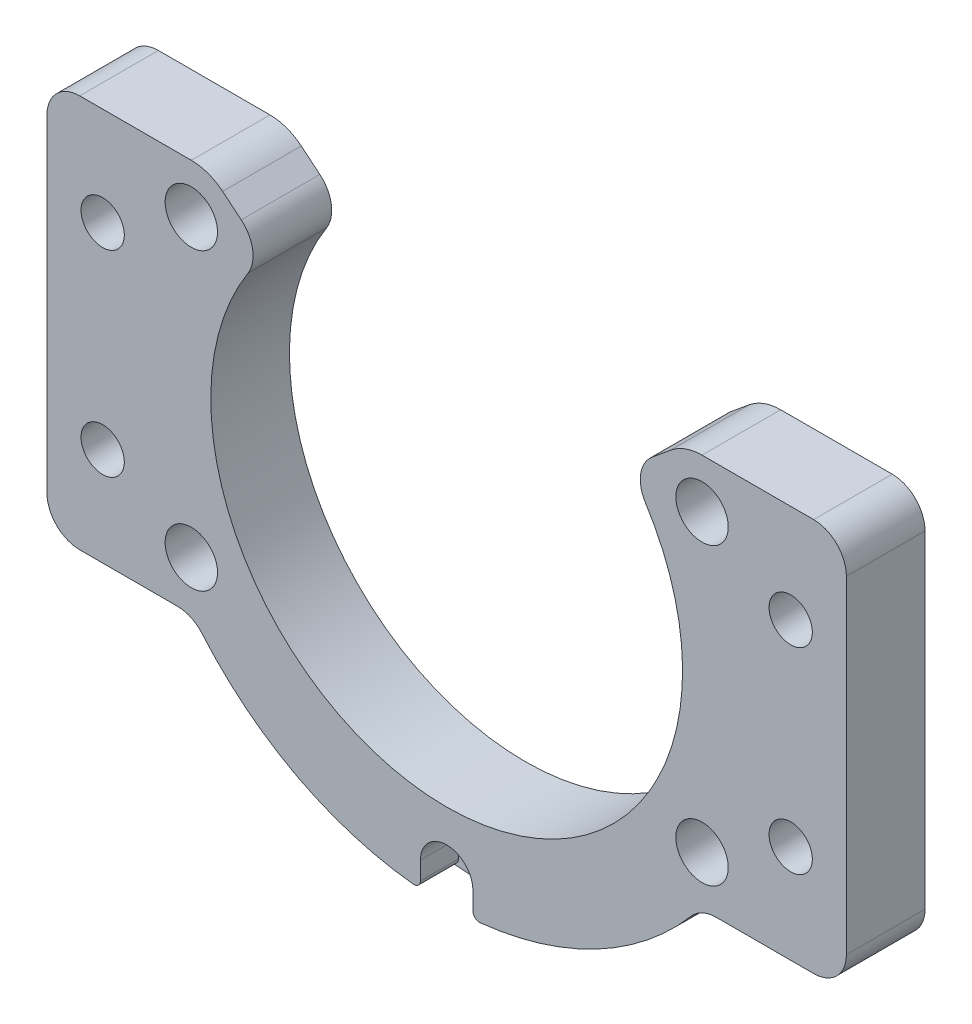
from build123d import *

# Parameters (mm, degrees)
EXTRUDE_1_DEPTH              = 12
CUT_EXTRUDE_1_DEPTH          = 80.158069709
CUT_EXTRUDE_START            = -5.8
CUT_EXTRUDE_2_DEPTH          = 5.8
HOLE_WIZARD_4_5_4_5_1_D      = 4.5
HOLE_WIZARD_M64_1_D          = 72
HOLE_WIZARD_M6_1_D           = 6.6
HOLE_WIZARD_M6_1_CBORE_D     = 11
HOLE_WIZARD_M6_1_CBORE_DEPTH = 6.5
HOLE_WIZARD_M4_1_D           = 4.5
HOLE_WIZARD_M4_1_CBORE_D     = 8
HOLE_WIZARD_M4_1_CBORE_DEPTH = 5.8
FILLET_1_R                   = 1
FILLET_2_R                   = 5
FILLET_3_R                   = 7.5


with BuildPart() as part:
    # 草图1 → 凸台-拉伸1 (new body)
    with BuildSketch(Plane(origin=(0, 0, 0), x_dir=(-1, 0, 0), z_dir=(0, 0, -1))):
        with BuildLine():
            Line((61, -30), (61, 30))
            Line((61, 30), (-61, 30))
            Line((-61, 30), (-61, -30))
            Line((-61, -30), (-38.742741256, -30))
            ThreePointArc((-38.742741256, -30), (0, -49), (38.742741256, -30))
            Line((38.742741256, -30), (61, -30))
        make_face()
    extrude(amount=-EXTRUDE_1_DEPTH)

    # 草图2 → 切除-拉伸1 (cut, through all)
    with BuildSketch(Plane.XY.offset(12)):
        Polygon((-36.271415569, 30), (0, 0), (36.271415569, 30), align=None)
    extrude(amount=-CUT_EXTRUDE_1_DEPTH, mode=Mode.SUBTRACT)

    # 草图3 → 切除-拉伸2 (cut)
    with BuildSketch(Plane.XY.offset(12).offset(CUT_EXTRUDE_START)):
        with BuildLine():
            Line((4, -48.836461788), (4, -45))
            ThreePointArc((4, -45), (0, -41), (-4, -45))
            Line((-4, -45), (-4, -48.836461788))
            ThreePointArc((-4, -48.836461788), (0, -49), (4, -48.836461788))
        make_face()
    extrude(amount=CUT_EXTRUDE_2_DEPTH, mode=Mode.SUBTRACT)

    # Ø4.5 (4.5) 直径孔1 (through all)
    with Locations(Plane.XY.offset(6.2)):
        with Locations((0, -45)):
            Hole(HOLE_WIZARD_4_5_4_5_1_D / 2)

    # M64 间隙孔1 (through all)
    with Locations(Plane(origin=(0, 0, 0), x_dir=(-1, 0, 0), z_dir=(0, 0, -1))):
        with Locations((0, 0)):
            Hole(HOLE_WIZARD_M64_1_D / 2)

    # M6 六角头螺栓的柱形沉头孔1 (through all)
    with Locations(Plane(origin=(0, 0, 0), x_dir=(-1, 0, 0), z_dir=(0, 0, -1))):
        with Locations((-52.5, -15), (52.5, 15), (52.5, -15), (-52.5, 15)):
            CounterBoreHole(HOLE_WIZARD_M6_1_D / 2, HOLE_WIZARD_M6_1_CBORE_D / 2, HOLE_WIZARD_M6_1_CBORE_DEPTH)

    # M4 六角头机械螺钉的柱形沉头孔1 (through all)
    with Locations(Plane.XY.offset(12)):
        with Locations((38.97114317, 22.5), (38.97114317, -22.5), (-38.97114317, -22.5), (-38.97114317, 22.5)):
            CounterBoreHole(HOLE_WIZARD_M4_1_D / 2, HOLE_WIZARD_M4_1_CBORE_D / 2, HOLE_WIZARD_M4_1_CBORE_DEPTH)

    # 圆角1
    fillet_1_edges = [part.edges().sort_by_distance(p)[0] for p in [
        (4, -48.836461788, 9.1),
        (-4, -48.836461788, 9.1),
    ]]
    fillet(fillet_1_edges, radius=FILLET_1_R)

    # 圆角2
    fillet_2_edges = [part.edges().sort_by_distance(p)[0] for p in [
        (-38.742741256, -30, 6),
        (38.742741256, -30, 6),
        (61, -30, 6),
        (61, 30, 6),
        (-61, 30, 6),
        (-61, -30, 6),
        (-27.740852298, 22.944391772, 6),
        (27.740852298, 22.944391772, 6),
    ]]
    fillet(fillet_2_edges, radius=FILLET_2_R)

    # 圆角3
    fillet_3_edges = [part.edges().sort_by_distance(p)[0] for p in [
        (-36.271415569, 30, 6),
        (36.271415569, 30, 6),
    ]]
    fillet(fillet_3_edges, radius=FILLET_3_R)


solid = part.part
